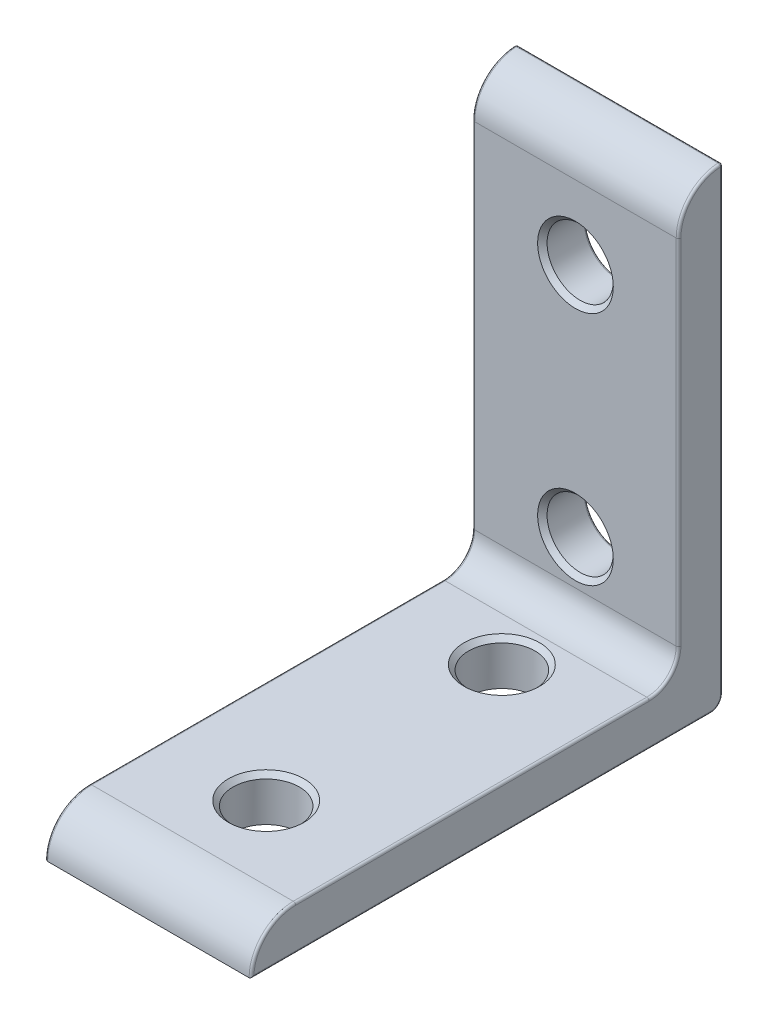
from build123d import *

# Parameters (mm, degrees)
BOSS_EXTRUDE1_START = 11.1125
BOSS_EXTRUDE1_DEPTH = 22.225
FILLET1_R           = 1.2715875
SKETCH4_R           = 3.5687
CUT_EXTRUDE1_DEPTH  = 54.741037043
SKETCH6_R           = 3.5687
CUT_EXTRUDE3_DEPTH  = 7.874
CHAMFER1_SIZE       = 0.508
FILLET2_R           = 0.254


with BuildPart() as part:
    # Sketch3 → Boss-Extrude1 (new body)
    with BuildSketch(Plane(origin=(0, 0, 0), x_dir=(0, 0, -1), z_dir=(1, 0, 0)).offset(BOSS_EXTRUDE1_START)):
        with BuildLine():
            Line((-3.175, -20.6375), (-41.275, -20.6375))
            ThreePointArc((-41.275, -20.6375), (-44.642596045, -22.032403955), (-46.0375, -25.4))
            Line((-46.0375, -25.4), (4.7625, -25.4))
            Line((4.7625, -25.4), (4.7625, 25.4))
            ThreePointArc((4.7625, 25.4), (1.394903955, 24.005096045), (0, 20.6375))
            Line((0, 20.6375), (0, -17.4625))
            ThreePointArc((0, -17.4625), (-0.92993597, -19.70756403), (-3.175, -20.6375))
        make_face()
    extrude(amount=-BOSS_EXTRUDE1_DEPTH)

    # Fillet1
    fillet1_edges = [part.edges().sort_by_distance(p)[0] for p in [
        (0, -25.4, -4.7625),
    ]]
    fillet(fillet1_edges, radius=FILLET1_R)

    # Sketch4 → Cut-Extrude1 (cut, through all)
    with BuildSketch(Plane.XY):
        with Locations((0, 12.7)):
            Circle(SKETCH4_R)
        with Locations(Location((0, -12.7, 0), (0, 0, 180))):
            Circle(SKETCH4_R)
    extrude(amount=-CUT_EXTRUDE1_DEPTH, mode=Mode.SUBTRACT)

    # Sketch6 → Cut-Extrude3 (cut)
    with BuildSketch(Plane(origin=(0, -20.6375, 0), x_dir=(1, 0, 0), z_dir=(0, 1, 0))):
        with Locations(Location((0, -7.9375, 0), (0, 0, 270))):
            Circle(SKETCH6_R)
        with Locations(Location((0, -33.3375, 0), (0, 0, 270))):
            Circle(SKETCH6_R)
    extrude(amount=-CUT_EXTRUDE3_DEPTH, mode=Mode.SUBTRACT)

    # Chamfer1
    chamfer1_edges = [part.edges().sort_by_distance(p)[0] for p in [
        (-3.5687, 12.7, 0),
        (3.5687, -12.7, 0),
        (0, -20.6375, 4.3688),
        (0, -20.6375, 29.7688),
    ]]
    chamfer(chamfer1_edges, length=CHAMFER1_SIZE)

    # Fillet2
    fillet2_edges = [part.edges().sort_by_distance(p)[0] for p in [
        (0, 25.4, -4.7625),
        (-11.1125, 24.005096045, -1.394903955),
        (-11.1125, 1.5875, 0),
        (-11.1125, -19.70756403, 0.92993597),
        (11.1125, 0.63579375, -4.7625),
        (-11.1125, -20.6375, 22.225),
        (11.1125, -25.027560644, -4.390060644),
        (-11.1125, 0.63579375, -4.7625),
        (-11.1125, -25.027560644, -4.390060644),
        (-3.5687, 12.7, -4.7625),
        (3.5687, -12.7, -4.7625),
        (-11.1125, -22.032403955, 44.642596045),
        (11.1125, -20.6375, 22.225),
        (-11.1125, -25.4, 21.27329375),
        (11.1125, -19.70756403, 0.92993597),
        (11.1125, 1.5875, 0),
        (11.1125, 24.005096045, -1.394903955),
        (11.1125, -25.4, 21.27329375),
        (11.1125, -22.032403955, 44.642596045),
    ]]
    fillet(fillet2_edges, radius=FILLET2_R)


solid = part.part
